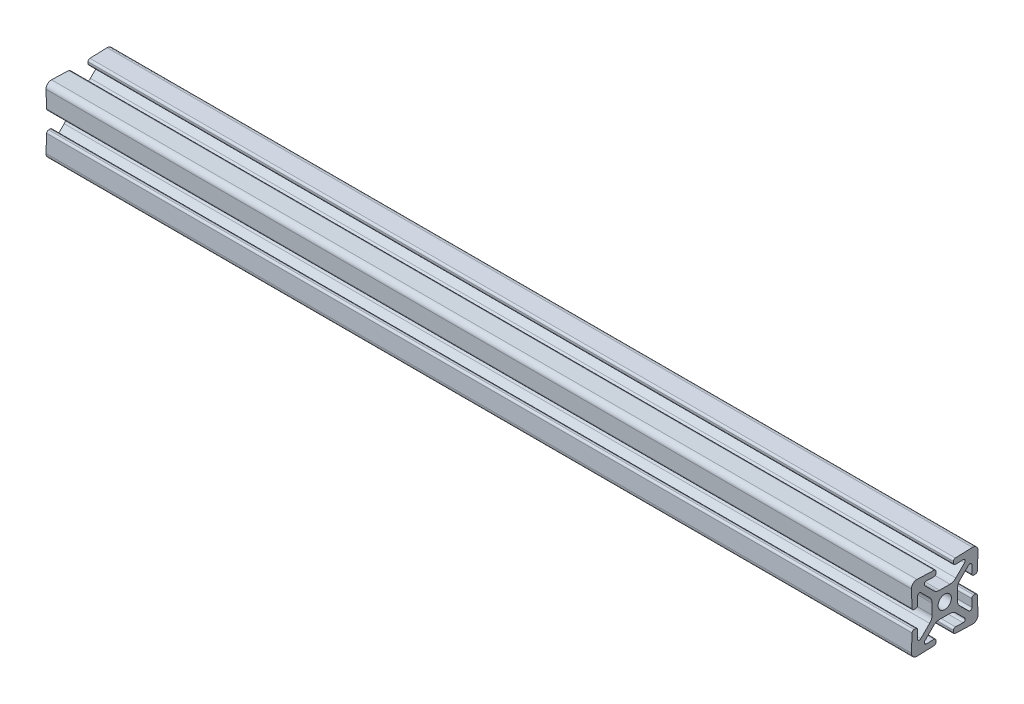
from build123d import *

# Parameters (mm, degrees)
BOSS_EXTRUDE1_DEPTH      = 165.1
BOSS_EXTRUDE1_DEPTH_BACK = 165.1


with BuildPart() as part:
    # Sketch3 → Boss-Extrude1 (new, two sides: drawn at the far end of the back side and taken through both)
    with BuildSketch(Plane(origin=(0, 0, 0), x_dir=(0, 0, -1), z_dir=(1, 0, 0)).offset(-BOSS_EXTRUDE1_DEPTH_BACK)):
        with BuildLine():
            Line((0, 4.826), (1.984228399, 4.826))
            ThreePointArc((1.984228399, 4.826), (3.199248297, 5.067682484), (4.229292429, 5.75593597))
            Line((4.229292429, 5.75593597), (7.586577723, 9.113221264))
            ThreePointArc((7.586577723, 9.113221264), (7.746562132, 9.955883421), (7.021168939, 10.413572441))
            Line((7.021168939, 10.413572441), (4.090593416, 10.311234489))
            ThreePointArc((4.090593416, 10.311234489), (3.534670322, 10.524633371), (3.302, 11.072770299))
            Line((3.302, 11.072770299), (3.302, 11.70815736))
            ThreePointArc((3.302, 11.70815736), (3.515863072, 12.237487038), (4.037406584, 12.46969317))
            Line((4.037406584, 12.46969317), (10.597084223, 12.698762161))
            ThreePointArc((10.597084223, 12.698762161), (12.104840979, 12.104840979), (12.698762161, 10.597084223))
            Line((12.698762161, 10.597084223), (12.46969317, 4.037406584))
            ThreePointArc((12.46969317, 4.037406584), (12.237487038, 3.515863072), (11.70815736, 3.302))
            Line((11.70815736, 3.302), (11.072770299, 3.302))
            ThreePointArc((11.072770299, 3.302), (10.524633371, 3.534670322), (10.311234489, 4.090593416))
            Line((10.311234489, 4.090593416), (10.413572441, 7.021168939))
            ThreePointArc((10.413572441, 7.021168939), (9.955883421, 7.746562132), (9.113221264, 7.586577723))
            Line((9.113221264, 7.586577723), (5.75593597, 4.229292429))
            ThreePointArc((5.75593597, 4.229292429), (5.067682484, 3.199248297), (4.826, 1.984228399))
            Line((4.826, 1.984228399), (4.826, 0))
            Line((4.826, 0), (2.54, 0))
            ThreePointArc((2.54, 0), (1.796051224, 1.796051224), (0, 2.54))
            Line((0, 2.54), (0, 4.826))
        make_face()
    extrude(amount=BOSS_EXTRUDE1_DEPTH + BOSS_EXTRUDE1_DEPTH_BACK)

    # Mirror1: part across plane


with BuildPart() as part_1:
    add(part.part)
    add(part.part.mirror(Plane.ZX))

    # Mirror2: part across plane


with BuildPart() as part_2:
    add(part_1.part)
    add(part_1.part.mirror(Plane.XY))


solid = part_2.part
